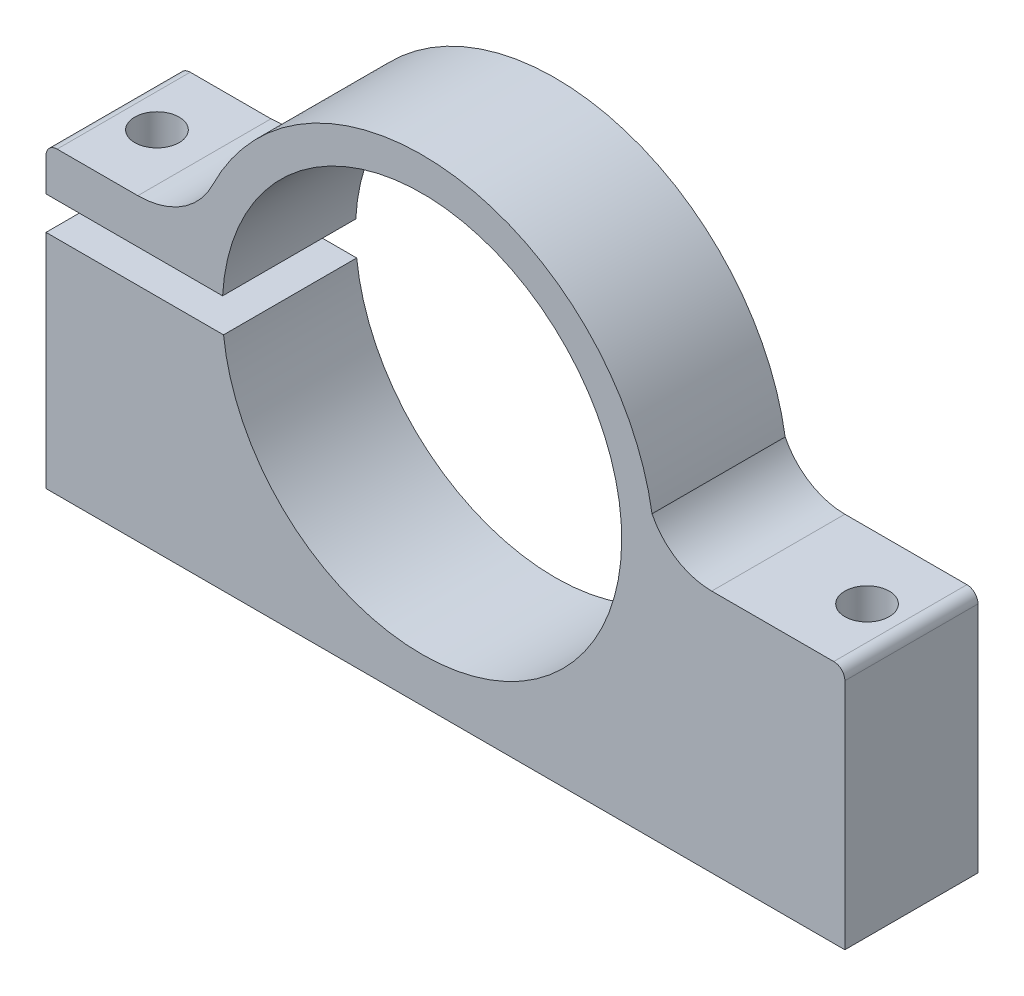
from build123d import *

# Parameters (mm, degrees)
BOSS_EXTRU_1_DEPTH      = 12
ESQUISSE2_R             = 2
ENL_V_MAT_EXTRU_2_DEPTH = 85.717176535
ESQUISSE2_4_R           = 2
ENL_V_MAT_EXTRU_3_DEPTH = 32
CONG_1_R                = 1


with BuildPart() as part:
    # Esquisse1 → Boss.-Extru.1 (new body)
    with BuildSketch(Plane.XY):
        with BuildLine():
            Line((0, 0), (72, 0))
            Line((72, 0), (72, 22))
            Line((72, 22), (60, 22))
            ThreePointArc((60, 22), (56.833671471, 22.903494958), (54.620930228, 25.341878785))
            ThreePointArc((54.620930228, 25.341878785), (36.966721004, 42.773175617), (15.016177647, 31.210526316))
            ThreePointArc((15.016177647, 31.210526316), (12.249643941, 28.139141071), (8.27604687, 27))
            Line((8.27604687, 27), (0, 27))
            Line((0, 27), (0, 23))
            Line((0, 23), (15.916343064, 23))
            ThreePointArc((15.916343064, 23), (51.881549416, 22.50174657), (16, 20))
            Line((16, 20), (0, 20))
            Line((0, 20), (0, 0))
        make_face()
    extrude(amount=BOSS_EXTRU_1_DEPTH)

    # Esquisse2 → Enlèv. mat.-Extru.2 (cut, through all)
    with BuildSketch(Plane(origin=(0, 0, 0), x_dir=(-1, 0, 0), z_dir=(0, -1, 0))):
        with Locations((-4, -6)):
            Circle(ESQUISSE2_R)
    extrude(amount=-ENL_V_MAT_EXTRU_2_DEPTH, mode=Mode.SUBTRACT)

    # Esquisse2<4> → Enlèv. mat.-Extru.3 (cut)
    with BuildSketch(Plane(origin=(0, 0, 0), x_dir=(-1, 0, 0), z_dir=(0, -1, 0))):
        with Locations((-4, -6)):
            Circle(ESQUISSE2_4_R)
        with Locations((-68, -6)):
            Circle(ESQUISSE2_4_R)
    extrude(amount=-ENL_V_MAT_EXTRU_3_DEPTH, mode=Mode.SUBTRACT)

    # Congé1
    cong_1_edges = [part.edges().sort_by_distance(p)[0] for p in [
        (0, 27, 6),
        (72, 22, 6),
    ]]
    fillet(cong_1_edges, radius=CONG_1_R)


solid = part.part
